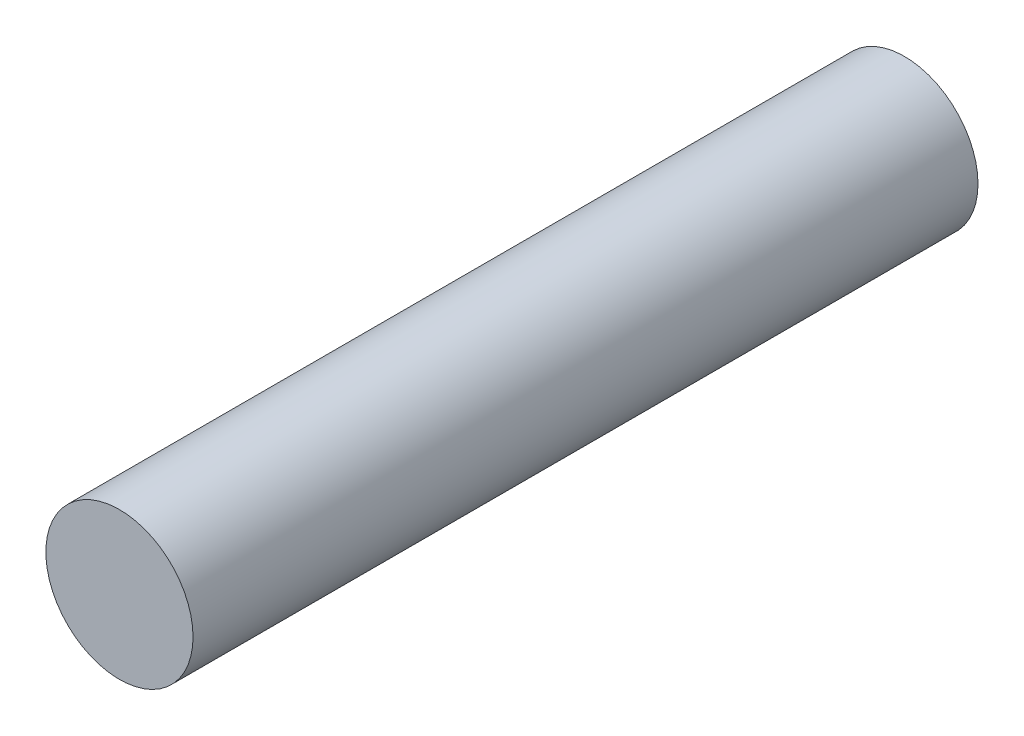
from build123d import *

# Parameters (mm, degrees)
SKETCH_2_R          = 7.5
EXTRUDE_1_DEPTH     = 80
SKETCH_2_3_R        = 4
CUT_EXTRUDE_1_DEPTH = 30


with BuildPart() as part:
    # 스케치2 → 보스-돌출1 (new body)
    with BuildSketch(Plane.XY):
        Circle(SKETCH_2_R)
    extrude(amount=EXTRUDE_1_DEPTH)

    # 스케치2<3> → 컷-돌출1 (cut)
    with BuildSketch(Plane.XY):
        Circle(SKETCH_2_3_R)
    extrude(amount=CUT_EXTRUDE_1_DEPTH, mode=Mode.SUBTRACT)


solid = part.part
